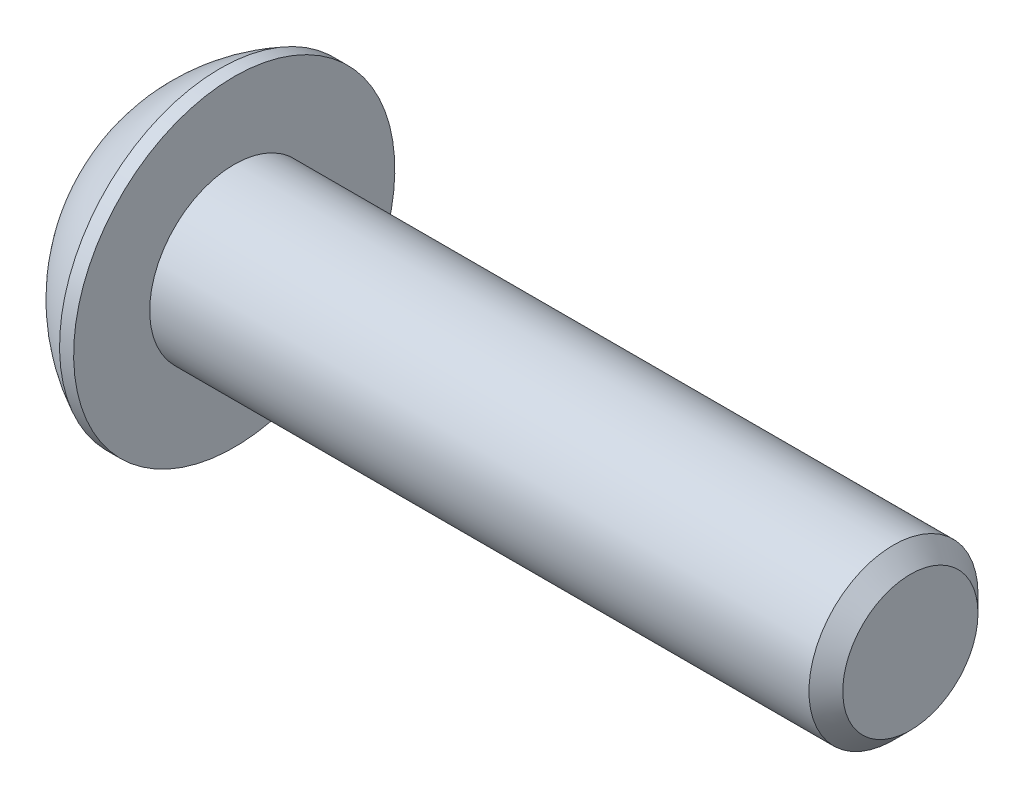
from build123d import *

# Parameters (mm, degrees)
SKETCH2_R           = 1.5
BOSS_EXTRUDE1_DEPTH = 12
CHAMFER1_SIZE       = 0.3
CUT_EXTRUDE1_DEPTH  = 1.2
SKETCH8_R           = 1.204700538
CUT_EXTRUDE2_DEPTH  = 1
CUT_EXTRUDE2_DRAFT  = -45


with BuildPart() as part:
    # Sketch2 → Boss-Extrude1 (new body)
    with BuildSketch(Plane(origin=(0, 0, 0), x_dir=(0, 0, -1), z_dir=(1, 0, 0))):
        Circle(SKETCH2_R)
    extrude(amount=-BOSS_EXTRUDE1_DEPTH)

    # Chamfer1
    chamfer1_edges = [part.edges().sort_by_distance(p)[0] for p in [
        (0, 0, 1.5),
    ]]
    chamfer(chamfer1_edges, length=CHAMFER1_SIZE)

    # Sketch6 → Revolve1 (revolve)
    with BuildSketch(Plane.XY):
        with BuildLine():
            Line((-13.65, 0), (-13.65, 1.5))
            ThreePointArc((-13.65, 1.5), (-13.055944823, 2.284868705), (-12.25, 2.85))
            Line((-12.25, 2.85), (-12, 2.85))
            Line((-12, 2.85), (-12, 0))
            Line((-12, 0), (-13.65, 0))
        make_face()
    revolve(axis=Axis((-12, 0, 0), (-1, 0, 0)))

    # Sketch7 → Cut-Extrude1 (cut)
    with BuildSketch(Plane.ZY.offset(13.65)):
        Polygon((0, 1.154700538), (-1, 0.577350269), (-1, -0.577350269), (0, -1.154700538), (1, -0.577350269), (1, 0.577350269), align=None)
    extrude(amount=-CUT_EXTRUDE1_DEPTH, mode=Mode.SUBTRACT)


with BuildPart() as cut_extrude2_tool:
    # Sketch8 → Cut-Extrude2 (with draft: the straight prism first)
    with BuildSketch(Plane.ZY.offset(13.65)):
        Circle(SKETCH8_R)
    extrude(amount=-CUT_EXTRUDE2_DEPTH)
    # Cut-Extrude2: the draft: its side faces are tilted about the plane it starts from
    cut_extrude2_sides = [cut_extrude2_tool.faces().sort_by_distance(p)[0] for p in [
        (-13.15, 0, -1.204700538),
    ]]
    draft(cut_extrude2_sides, Plane.ZY.offset(13.65), CUT_EXTRUDE2_DRAFT)


with BuildPart() as part_1:
    add(part.part)

    # Cut-Extrude2: cut by cut_extrude2_tool
    add(cut_extrude2_tool.part, mode=Mode.SUBTRACT)


solid = part_1.part
